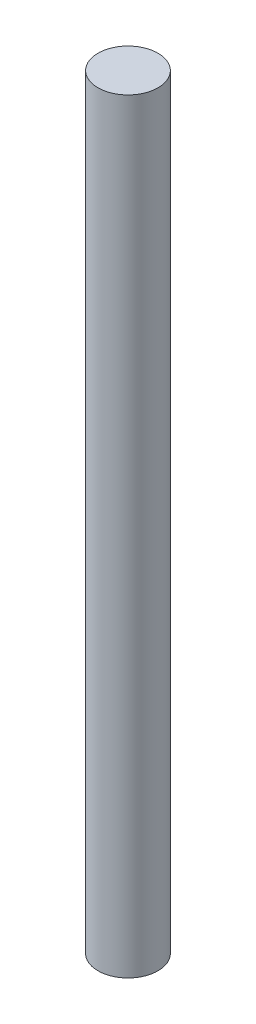
from build123d import *

# Parameters (mm, degrees)
SKETCH1_R           = 4
BOSS_EXTRUDE1_DEPTH = 102


with BuildPart() as part:
    # Sketch1 → Boss-Extrude1 (new body)
    with BuildSketch(Plane(origin=(0, 0, 0), x_dir=(1, 0, 0), z_dir=(0, 1, 0))):
        with Locations(Location((0, 0, 0), (0, 0, 270))):
            Circle(SKETCH1_R)
    extrude(amount=BOSS_EXTRUDE1_DEPTH)


solid = part.part
